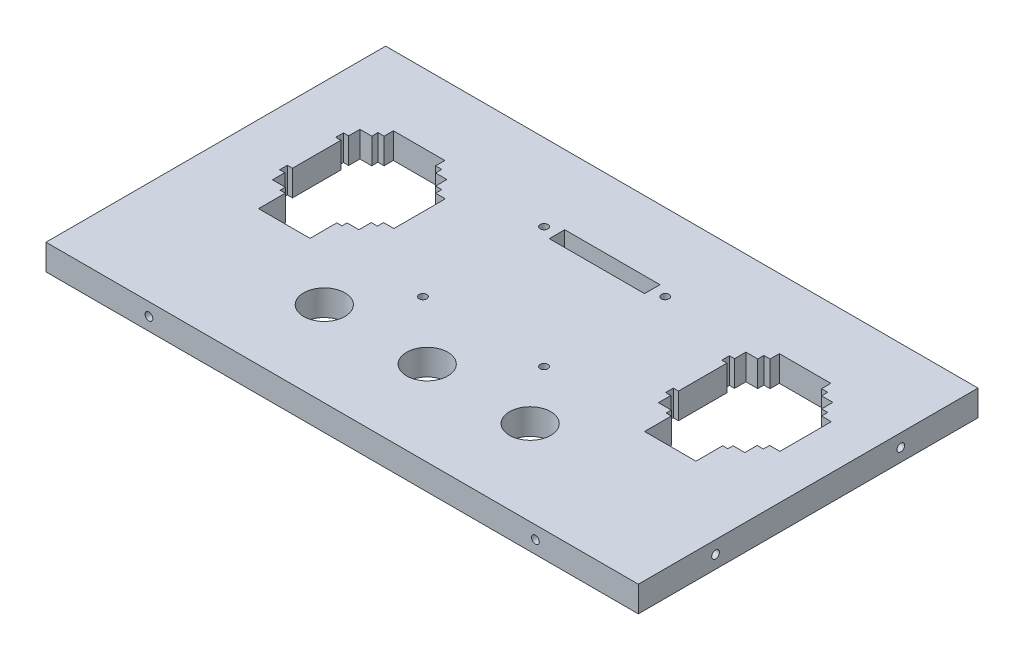
from build123d import *

# Parameters (mm, degrees)
SKETCH_1_W             = 115.1
SKETCH_1_H             = 66
EXTRUDE_1_DEPTH        = 5
SKETCH_1_3_W           = 1
SKETCH_1_3_H           = 1
SKETCH_1_3_H_2         = 1.5
SKETCH_1_3_W_2         = 1.2
SKETCH_1_3_H_3         = 1.2
CUT_EXTRUDE_1_DEPTH    = 133.774282148
PATTERN_LINEAR_1_COUNT = 2
PATTERN_LINEAR_1_PITCH = 75
SKETCH_1_4_R           = 0.75
SKETCH_1_4_W           = 18.5
SKETCH_1_4_H           = 3
CUT_EXTRUDE_2_DEPTH    = 133.774282148
SKETCH_2_R             = 4
CUT_EXTRUDE_3_DEPTH    = 133.774282148
SKETCH_5_R             = 0.75
CUT_EXTRUDE_4_DEPTH    = 3
SKETCH_6_R             = 0.75
CUT_EXTRUDE_5_DEPTH    = 4
CUT_EXTRUDE_START      = -111.1
SKETCH_6_4_R           = 0.75
CUT_EXTRUDE_6_DEPTH    = 4
SKETCH_7_R             = 0.75
CUT_EXTRUDE_7_DEPTH    = 4
CUT_EXTRUDE_START_2    = -62
SKETCH_7_2_R           = 0.75
CUT_EXTRUDE_8_DEPTH    = 4


with BuildPart() as part:
    # 草图1 → 凸台-拉伸1 (new body)
    with BuildSketch(Plane(origin=(0, 0, 0), x_dir=(1, 0, 0), z_dir=(0, 1, 0))):
        with Locations((57.55, -33)):
            Rectangle(SKETCH_1_W, SKETCH_1_H)
    extrude(amount=EXTRUDE_1_DEPTH)

    # 草图1<3> → 切除-拉伸1 (cut, through all)
    with BuildSketch(Plane(origin=(0, 0, 0), x_dir=(1, 0, 0), z_dir=(0, 1, 0))):
        Polygon((25, -33.5), (15, -33.5), (15, -34.5), (15, -39.7), (25, -39.7), (25, -34.5), align=None)
        with Locations((25.5, -34)):
            Rectangle(SKETCH_1_3_W, SKETCH_1_3_H)
        with Locations((14.5, -34)):
            Rectangle(SKETCH_1_3_W, SKETCH_1_3_H)
        Polygon((11.5, -16.5), (11.5, -18.7), (11.5, -20.2), (11.5, -29.6), (11.5, -31.1), (11.5, -33.5), (14, -33.5), (15, -33.5), (25, -33.5), (26, -33.5), (28.3, -33.5), (28.3, -31.1), (28.3, -29.9), (29.5, -29.9), (31.5, -29.9), (31.5, -19.9), (29.6, -19.9), (28.4, -19.9), (25, -19.9), (25, -16.5), (25, -15.3), (25, -13.5), (15, -13.5), (15, -15.3), (15, -16.5), (13.8, -16.5), align=None)
        with Locations((11, -30.35)):
            Rectangle(SKETCH_1_3_W, SKETCH_1_3_H_2)
        with Locations((11, -19.45)):
            Rectangle(SKETCH_1_3_W, SKETCH_1_3_H_2)
        with Locations((25.6, -15.9)):
            Rectangle(SKETCH_1_3_W_2, SKETCH_1_3_H_3)
        Polygon((26.2, -16.5), (25, -16.5), (25, -19.9), (28.4, -19.9), (28.4, -18.7), (28.4, -16.5), align=None)
        with Locations((29, -19.3)):
            Rectangle(SKETCH_1_3_W_2, SKETCH_1_3_H_3)
        with Locations((28.9, -30.5)):
            Rectangle(SKETCH_1_3_W_2, SKETCH_1_3_H_3)
        with Locations((14.4, -15.9)):
            Rectangle(SKETCH_1_3_W_2, SKETCH_1_3_H_3)
    cut_extrude_1 = extrude(amount=CUT_EXTRUDE_1_DEPTH, mode=Mode.SUBTRACT)

    # 阵列(线性)1: 切除-拉伸1 ×2
    with Locations(*[(i * PATTERN_LINEAR_1_PITCH, 0, 0) for i in range(1, PATTERN_LINEAR_1_COUNT)]):
        add(cut_extrude_1, mode=Mode.SUBTRACT)

    # 草图1<4> → 切除-拉伸2 (cut, through all)
    with BuildSketch(Plane(origin=(0, 0, 0), x_dir=(1, 0, 0), z_dir=(0, 1, 0))):
        with Locations(Location((45.78, -15, 0), (0, 0, 270))):
            Circle(SKETCH_1_4_R)
        with Locations(Location((69.32, -15, 0), (0, 0, 270))):
            Circle(SKETCH_1_4_R)
        with Locations(Location((45.78, -38.545, 0), (0, 0, 270))):
            Circle(SKETCH_1_4_R)
        with Locations(Location((69.32, -38.545, 0), (0, 0, 270))):
            Circle(SKETCH_1_4_R)
        with Locations((57.55, -15)):
            Rectangle(SKETCH_1_4_W, SKETCH_1_4_H)
    extrude(amount=CUT_EXTRUDE_2_DEPTH, mode=Mode.SUBTRACT)

    # 草图2 → 切除-拉伸3 (cut, through all)
    with BuildSketch(Plane(origin=(0, 5, 0), x_dir=(1, 0, 0), z_dir=(0, 1, 0))):
        with Locations(Location((37.55, -49.474447741, 0), (0, 0, 270))):
            Circle(SKETCH_2_R)
        with Locations(Location((57.55, -49.474447741, 0), (0, 0, 270))):
            Circle(SKETCH_2_R)
        with Locations(Location((77.55, -49.474447741, 0), (0, 0, 270))):
            Circle(SKETCH_2_R)
    extrude(amount=-CUT_EXTRUDE_3_DEPTH, mode=Mode.SUBTRACT)

    # 草图5 → 切除-拉伸4 (cut)
    with BuildSketch(Plane.XZ):
        with Locations(Location((104.5, 35.5, 0), (0, 0, 270))):
            Circle(SKETCH_5_R)
        with Locations(Location((86.5, 13.5, 0), (0, 0, 270))):
            Circle(SKETCH_5_R)
        with Locations(Location((104.5, 13.5, 0), (0, 0, 270))):
            Circle(SKETCH_5_R)
        with Locations(Location((86.5, 35.5, 0), (0, 0, 270))):
            Circle(SKETCH_5_R)
        with Locations(Location((11.5, 35.5, 0), (0, 0, 270))):
            Circle(SKETCH_5_R)
        with Locations(Location((11.5, 13.5, 0), (0, 0, 270))):
            Circle(SKETCH_5_R)
        with Locations(Location((29.5, 13.5, 0), (0, 0, 270))):
            Circle(SKETCH_5_R)
        with Locations(Location((29.5, 35.5, 0), (0, 0, 270))):
            Circle(SKETCH_5_R)
        with Locations(Location((47.05, 48.924447741, 0), (0, 0, 270))):
            Circle(SKETCH_5_R)
        with Locations(Location((68.05, 48.924447741, 0), (0, 0, 270))):
            Circle(SKETCH_5_R)
    extrude(amount=-CUT_EXTRUDE_4_DEPTH, mode=Mode.SUBTRACT)

    # 草图6 → 切除-拉伸5 (cut)
    with BuildSketch(Plane.ZY):
        with Locations((15, 2.5)):
            Circle(SKETCH_6_R)
        with Locations((51, 2.5)):
            Circle(SKETCH_6_R)
    extrude(amount=-CUT_EXTRUDE_5_DEPTH, mode=Mode.SUBTRACT)

    # 草图6<4> → 切除-拉伸6 (cut)
    with BuildSketch(Plane.ZY.offset(CUT_EXTRUDE_START)):
        with Locations((15, 2.5)):
            Circle(SKETCH_6_4_R)
        with Locations((51, 2.5)):
            Circle(SKETCH_6_4_R)
    extrude(amount=-CUT_EXTRUDE_6_DEPTH, mode=Mode.SUBTRACT)

    # 草图7 → 切除-拉伸7 (cut)
    with BuildSketch(Plane.XY.offset(66)):
        with Locations((95.1, 2.5)):
            Circle(SKETCH_7_R)
        with Locations((20, 2.5)):
            Circle(SKETCH_7_R)
    extrude(amount=-CUT_EXTRUDE_7_DEPTH, mode=Mode.SUBTRACT)

    # 草图7<2> → 切除-拉伸8 (cut)
    with BuildSketch(Plane.XY.offset(66).offset(CUT_EXTRUDE_START_2)):
        with Locations((95.1, 2.5)):
            Circle(SKETCH_7_2_R)
        with Locations((20, 2.5)):
            Circle(SKETCH_7_2_R)
    extrude(amount=-CUT_EXTRUDE_8_DEPTH, mode=Mode.SUBTRACT)


solid = part.part
